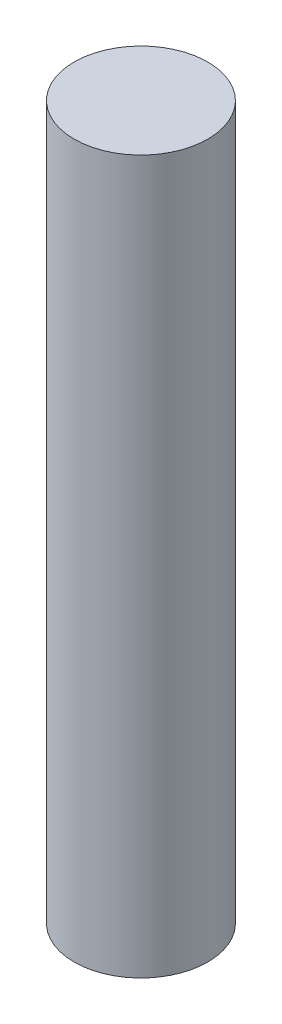
from build123d import *

# Parameters (mm, degrees)
SKETCH1_R           = 9.525
BOSS_EXTRUDE1_DEPTH = 101.6


with BuildPart() as part:
    # Sketch1 → Boss-Extrude1 (new body)
    with BuildSketch(Plane(origin=(0, 0, 0), x_dir=(1, 0, 0), z_dir=(0, 1, 0))):
        with Locations(Location((0, 0, 0), (0, 0, 270))):
            Circle(SKETCH1_R)
    extrude(amount=-BOSS_EXTRUDE1_DEPTH)


solid = part.part
